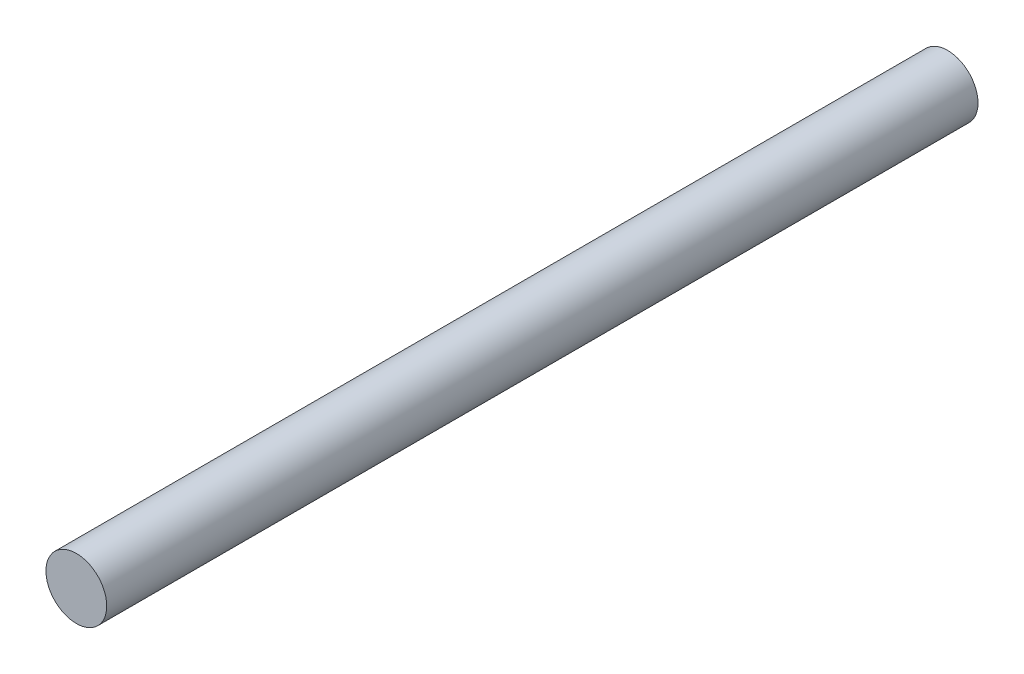
from build123d import *

# Parameters (mm, degrees)
SKETCH1_R           = 1.5
BOSS_EXTRUDE1_DEPTH = 43


with BuildPart() as part:
    # Sketch1 → Boss-Extrude1 (new body)
    with BuildSketch(Plane.XY):
        Circle(SKETCH1_R)
    extrude(amount=BOSS_EXTRUDE1_DEPTH)


solid = part.part
